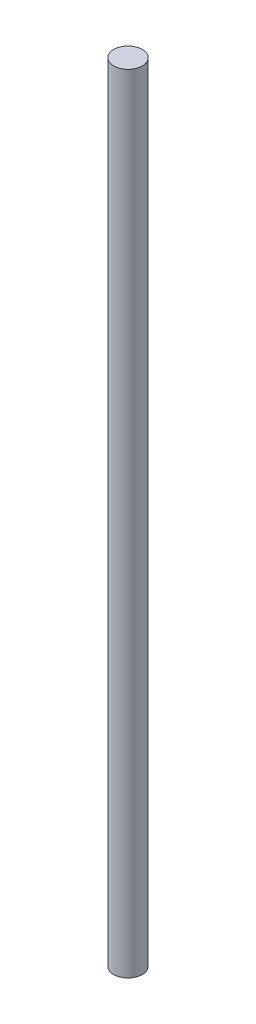
from build123d import *

# Parameters (mm, degrees)
SKETCH1_R           = 3
BOSS_EXTRUDE1_DEPTH = 165


with BuildPart() as part:
    # Sketch1 → Boss-Extrude1 (new body)
    with BuildSketch(Plane(origin=(0, 0, 0), x_dir=(1, 0, 0), z_dir=(0, 1, 0))):
        with Locations(Location((-5.326822835, 0, 0), (0, 0, 270))):
            Circle(SKETCH1_R)
    extrude(amount=BOSS_EXTRUDE1_DEPTH)


solid = part.part
